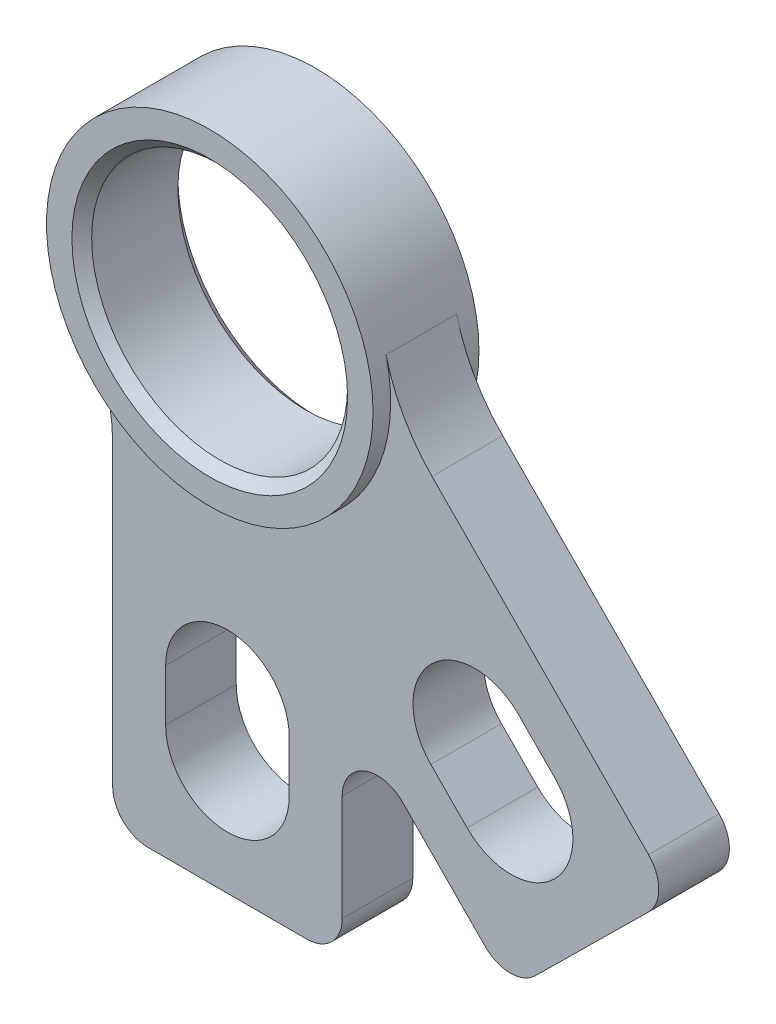
from build123d import *

# Parameters (mm, degrees)
SKETCH1_R           = 11.5062
BOSS_EXTRUDE2_DEPTH = 4.7625
BOSS_EXTRUDE3_DEPTH = 3.175
FILLET1_R           = 3.175
CHAMFER1_SIZE       = 0.889


with BuildPart() as part:
    # Sketch1 → Boss-Extrude2 (new, symmetric)
    with BuildSketch(Plane.XY):
        with BuildLine():
            ThreePointArc((14.266610953, 3.464310227), (-5.575798706, 13.58116719), (-12.585193267, -7.559797873))
            ThreePointArc((-12.585193267, -7.559797873), (5.575798706, -13.58116719), (14.266610953, 3.464310227))
        make_face()
        Circle(SKETCH1_R, mode=Mode.SUBTRACT)
    extrude(amount=BOSS_EXTRUDE2_DEPTH, both=True)

    # Sketch1<4> → Boss-Extrude3 (add, symmetric)
    with BuildSketch(Plane.XY):
        with BuildLine():
            ThreePointArc((-12.585193267, -7.559797873), (-10.89585042, -11.492870345), (-10.31875, -15.734319794))
            Line((-10.31875, -15.734319794), (-10.31875, -45.604827057))
            Line((-10.31875, -45.604827057), (10.31875, -45.604827057))
            Line((10.31875, -45.604827057), (10.31875, -25.13373892))
            Line((10.31875, -25.13373892), (25.417070257, -40.422155516))
            Line((25.417070257, -40.422155516), (40.100990921, -25.920814882))
            Line((40.100990921, -25.920814882), (18.397986061, -3.944556991))
            ThreePointArc((18.397986061, -3.944556991), (15.828265578, -0.52118512), (14.266610953, 3.464310227))
            ThreePointArc((14.266610953, 3.464310227), (5.575798706, -13.58116719), (-12.585193267, -7.559797873))
        make_face()
        with BuildLine():
            ThreePointArc((5.55625, -35.286077057), (0, -40.842327057), (-5.55625, -35.286077057))
            Line((-5.55625, -35.286077057), (-5.55625, -30.63875))
            ThreePointArc((-5.55625, -30.63875), (0, -25.0825), (5.55625, -30.63875))
            Line((5.55625, -30.63875), (5.55625, -35.286077057))
        make_face(mode=Mode.SUBTRACT)
        with BuildLine():
            ThreePointArc((29.461723528, -21.925317773), (29.412567366, -29.782888123), (21.554997017, -29.733731961))
            Line((21.554997017, -29.733731961), (18.289462301, -26.427082328))
            ThreePointArc((18.289462301, -26.427082328), (18.338618463, -18.569511978), (26.196188813, -18.61866814))
            Line((26.196188813, -18.61866814), (29.461723528, -21.925317773))
        make_face(mode=Mode.SUBTRACT)
    extrude(amount=BOSS_EXTRUDE3_DEPTH, both=True)

    # Fillet1
    fillet1_edges = [part.edges().sort_by_distance(p)[0] for p in [
        (-10.31875, -45.604827057, 0),
        (40.100990921, -25.920814882, 0),
        (10.31875, -25.13373892, 0),
        (25.417070257, -40.422155516, 0),
        (10.31875, -45.604827057, 0),
    ]]
    fillet(fillet1_edges, radius=FILLET1_R)

    # Chamfer1
    chamfer1_edges = [part.edges().sort_by_distance(p)[0] for p in [
        (-11.5062, 0, -4.7625),
        (-11.5062, 0, 4.7625),
    ]]
    chamfer(chamfer1_edges, length=CHAMFER1_SIZE)


solid = part.part
